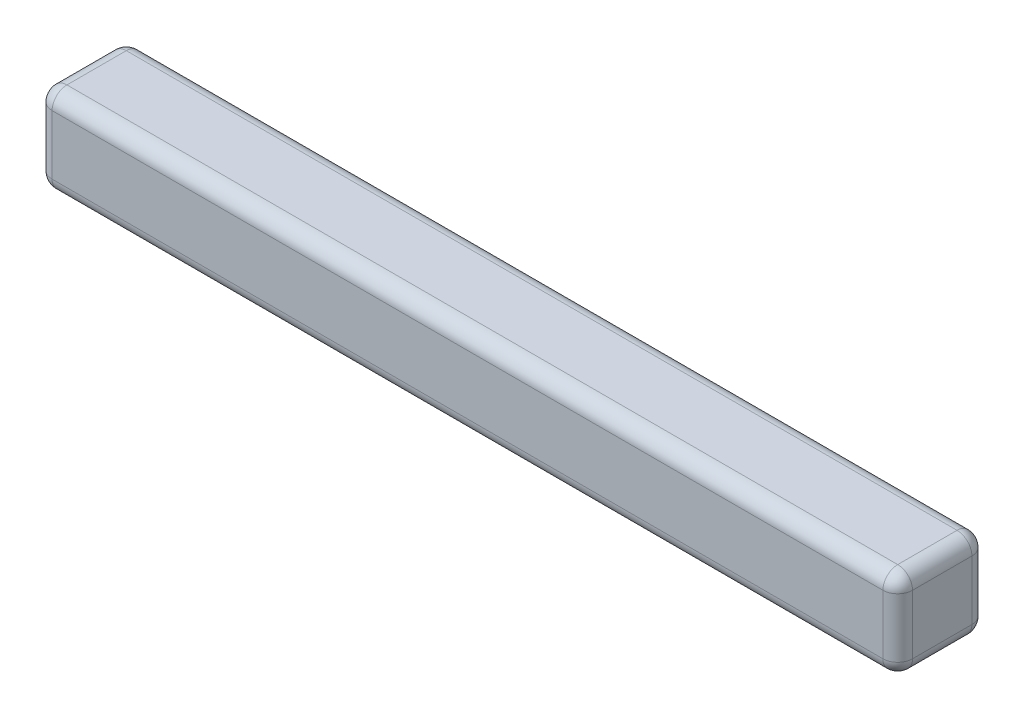
from build123d import *

# Parameters (mm, degrees)
BOSS_EXTRUDE1_START = 11.440071
SKETCH2_W           = 3
SKETCH2_H           = 3
BOSS_EXTRUDE1_DEPTH = 29
FILLET1_R           = 0.5
FILLET3_R           = 0.5


with BuildPart() as part:
    # Sketch2 → Boss-Extrude1 (new body)
    with BuildSketch(Plane(origin=(0, 0, 0), x_dir=(0, 0, -1), z_dir=(1, 0, 0)).offset(BOSS_EXTRUDE1_START)):
        with Locations((-38.793556796, 142.574028513)):
            Rectangle(SKETCH2_W, SKETCH2_H)
    extrude(amount=BOSS_EXTRUDE1_DEPTH)

    # Fillet1
    fillet1_edges = [part.edges().sort_by_distance(p)[0] for p in [
        (25.940071, 144.074028513, 40.293556796),
        (25.940071, 144.074028513, 37.293556796),
        (25.940071, 141.074028513, 37.293556796),
        (25.940071, 141.074028513, 40.293556796),
    ]]
    fillet(fillet1_edges, radius=FILLET1_R)

    # Fillet3
    fillet3_edges = [part.edges().sort_by_distance(p)[0] for p in [
        (40.440071, 144.074028513, 38.793556796),
        (11.440071, 144.074028513, 38.793556796),
        (11.440071, 142.574028513, 40.293556796),
        (11.440071, 142.574028513, 37.293556796),
        (11.440071, 141.074028513, 38.793556796),
        (11.440071, 141.220475122, 40.147110187),
        (11.440071, 141.220475122, 37.440003406),
        (11.440071, 143.927581903, 40.147110187),
        (11.440071, 143.927581903, 37.440003406),
        (40.440071, 142.574028513, 37.293556796),
        (40.440071, 141.074028513, 38.793556796),
        (40.440071, 142.574028513, 40.293556796),
        (40.440071, 141.220475122, 40.147110187),
        (40.440071, 141.220475122, 37.440003406),
        (40.440071, 143.927581903, 40.147110187),
        (40.440071, 143.927581903, 37.440003406),
    ]]
    fillet(fillet3_edges, radius=FILLET3_R)


solid = part.part
